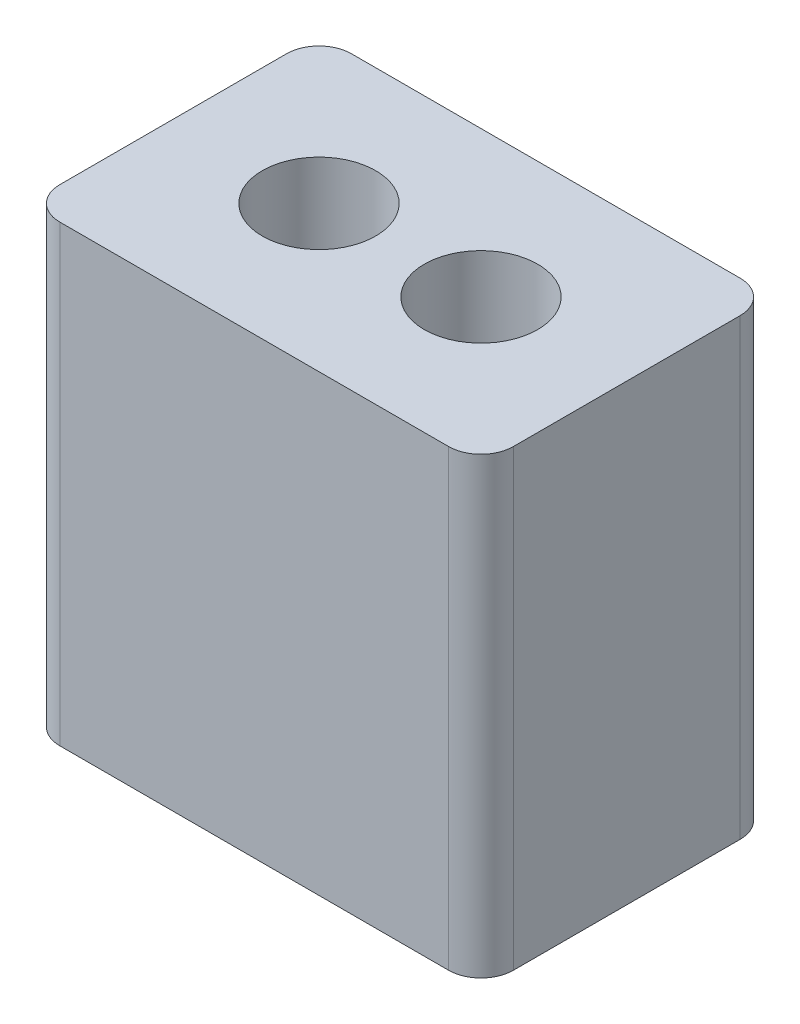
from build123d import *

# Parameters (mm, degrees)
SKETCH_1_W          = 14
SKETCH_1_H          = 9
EXTRUDE_1_DEPTH     = 14
FILLET_1_R          = 1
CUT_EXTRUDE_2_REACH = 18.286
SKETCH_3_R          = 1.75


with BuildPart() as part:
    # 草图1 → 凸台-拉伸1 (new body)
    with BuildSketch(Plane(origin=(0, 0, 0), x_dir=(1, 0, 0), z_dir=(0, 1, 0))):
        Rectangle(SKETCH_1_W, SKETCH_1_H)
    extrude(amount=EXTRUDE_1_DEPTH)

    # 圆角1
    fillet_1_edges = [part.edges().sort_by_distance(p)[0] for p in [
        (7, 7, 4.5),
        (-7, 7, 4.5),
        (-7, 7, -4.5),
        (7, 7, -4.5),
    ]]
    fillet(fillet_1_edges, radius=FILLET_1_R)

    # 草图3 → 切除-拉伸2 (cut, up to next)
    with BuildSketch(Plane(origin=(0, 14, 0), x_dir=(1, 0, 0), z_dir=(0, 1, 0)), mode=Mode.PRIVATE) as cut_extrude_2_sk1:
        with Locations(Location((-2.5, 0, 0), (0, 0, 270))):
            Circle(SKETCH_3_R)
    cut_extrude_2_tool1 = extrude(cut_extrude_2_sk1.sketch, amount=-CUT_EXTRUDE_2_REACH, mode=Mode.PRIVATE) & part.part
    # 草图3 → 切除-拉伸2 (cut, up to next)
    with BuildSketch(Plane(origin=(0, 14, 0), x_dir=(1, 0, 0), z_dir=(0, 1, 0)), mode=Mode.PRIVATE) as cut_extrude_2_sk2:
        with Locations(Location((2.5, 0, 0), (0, 0, 270))):
            Circle(SKETCH_3_R)
    cut_extrude_2_tool2 = extrude(cut_extrude_2_sk2.sketch, amount=-CUT_EXTRUDE_2_REACH, mode=Mode.PRIVATE) & part.part
    add(cut_extrude_2_tool1.solids().sort_by_distance((-2.5, 14, 0))[0], mode=Mode.SUBTRACT)
    add(cut_extrude_2_tool2.solids().sort_by_distance((2.5, 14, 0))[0], mode=Mode.SUBTRACT)


solid = part.part
